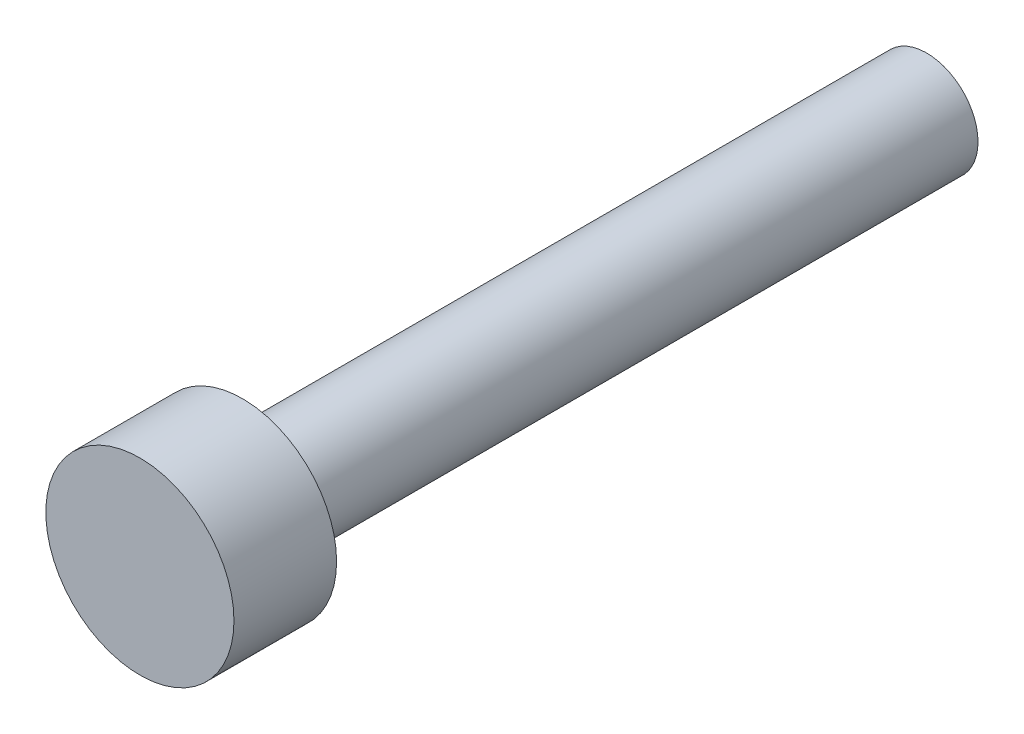
from build123d import *

# Parameters (mm, degrees)
SHANK_NOMINAL_THREAD_ENVELOPE_START     = -20
SHANK_NOMINAL_THREAD_ENVELOPE_PROFILE_R = 1.5
SHANK_NOMINAL_THREAD_ENVELOPE_DEPTH     = 20
SOCKET_HEAD_ENVELOPE_PROFILE_R          = 2.75
SOCKET_HEAD_ENVELOPE_DEPTH              = 3


with BuildPart() as part:
    # Shank_nominal_thread_envelope_profile → Shank_nominal_thread_envelope (new body)
    with BuildSketch(Plane.XY.offset(SHANK_NOMINAL_THREAD_ENVELOPE_START)):
        Circle(SHANK_NOMINAL_THREAD_ENVELOPE_PROFILE_R)
    extrude(amount=SHANK_NOMINAL_THREAD_ENVELOPE_DEPTH)

    # Socket_head_envelope_profile → Socket_head_envelope (add)
    with BuildSketch(Plane.XY):
        Circle(SOCKET_HEAD_ENVELOPE_PROFILE_R)
    extrude(amount=SOCKET_HEAD_ENVELOPE_DEPTH)


solid = part.part
